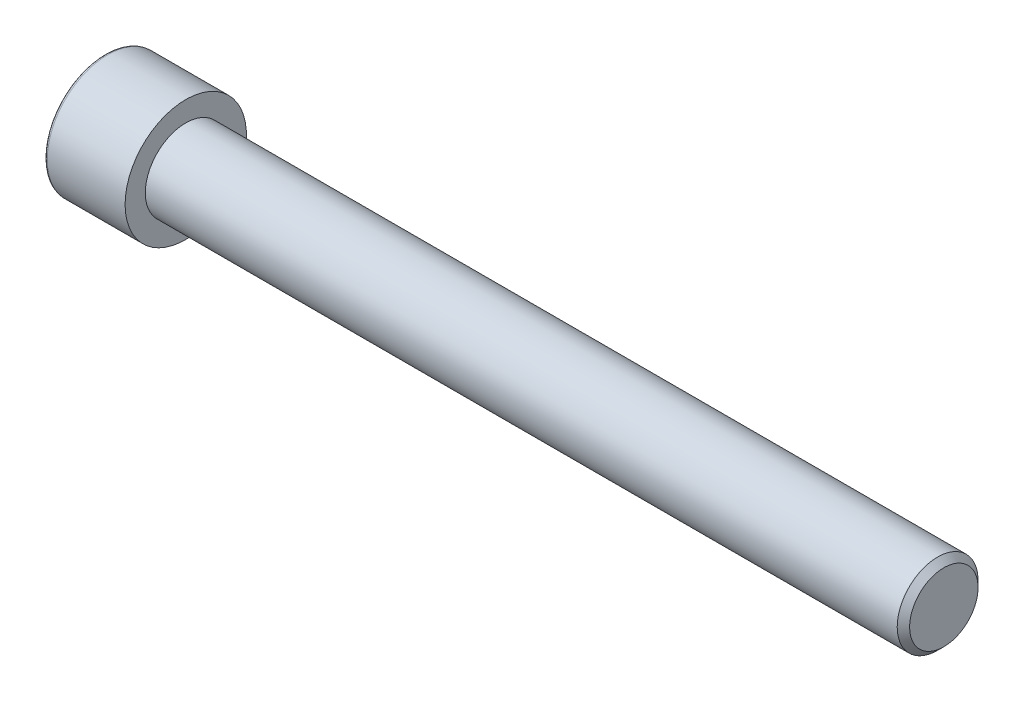
from build123d import *

# Parameters (mm, degrees)
SZKIC1_W                    = 16
SZKIC1_H                    = 12
SZKIC5_R                    = 9
DODANIE_WYCI_GNI_CIE1_DEPTH = 12


with BuildPart() as part:
    # Szkic1 → Obrót1 (revolve)
    with BuildSketch(Plane.XY):
        with Locations((8, 6)):
            Rectangle(SZKIC1_W, SZKIC1_H)
    revolve(axis=Axis((16, 0, 0), (-1, 0, 0)))

    # Szkic2 → Wycięcie-obrót1 (revolve, cut)
    with BuildSketch(Plane.XY):
        with BuildLine():
            Line((0, 12), (0, 11.4))
            ThreePointArc((0, 11.4), (0.175735931, 11.824264069), (0.6, 12))
            Line((0.6, 12), (0, 12))
        make_face()
    revolve(axis=Axis((16, 0, 0), (-1, 0, 0)), mode=Mode.SUBTRACT)

    # Szkic3 → Obrót2 (revolve)
    with BuildSketch(Plane.XY):
        Polygon((16, 0), (16, 8), (164.773, 8), (166, 6.773), (166, 0), align=None)
    revolve(axis=Axis((166, 0, 0), (-1, 0, 0)))

    # Szkic4 → Wycięcie-obrót2 (revolve, cut)
    with BuildSketch(Plane.XY):
        Polygon((0, 0), (0, 8.5), (8, 8.5), (12.907477288, 0), align=None)
    revolve(axis=Axis((12.907477288, 0, 0), (-1, 0, 0)), mode=Mode.SUBTRACT)

    # Szkic5 → Dodanie-wyciągnięcie1 (add)
    with BuildSketch(Plane(origin=(0, 0, 0), x_dir=(0, 0, -1), z_dir=(1, 0, 0))):
        Circle(SZKIC5_R)
        Polygon((-7, 4.041451884), (-7, -4.041451884), (0, -8.082903769), (7, -4.041451884), (7, 4.041451884), (0, 8.082903769), align=None, mode=Mode.SUBTRACT)
    extrude(amount=DODANIE_WYCI_GNI_CIE1_DEPTH)


solid = part.part
